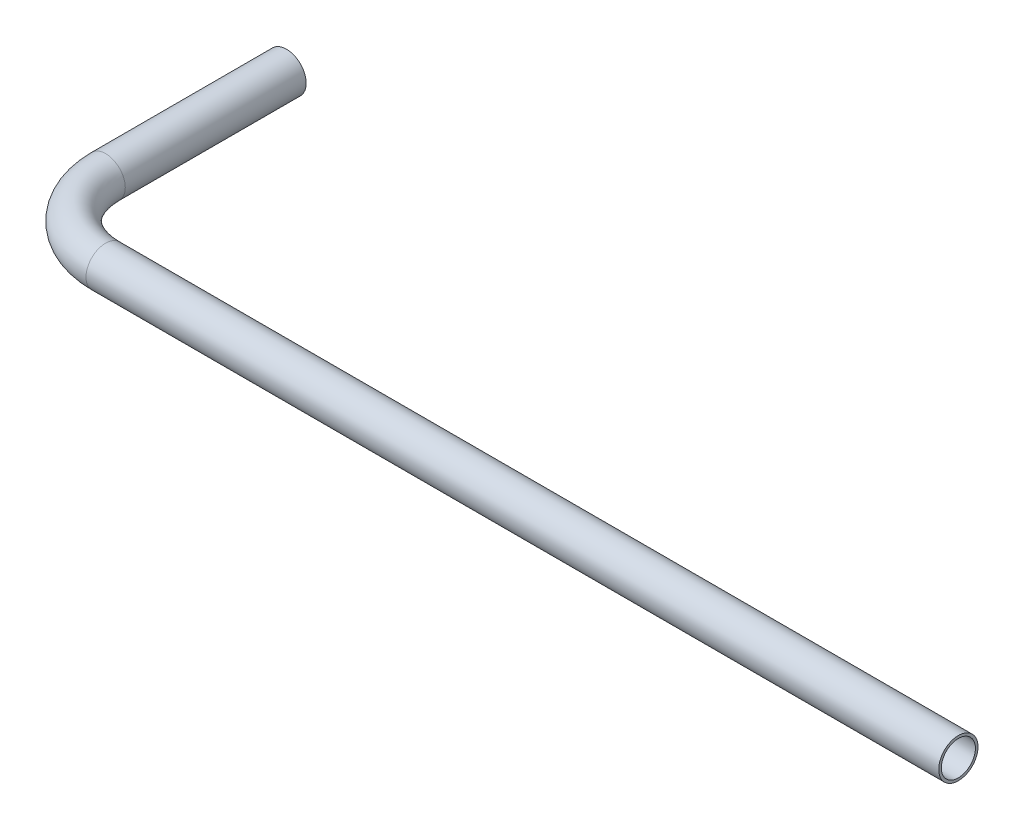
from build123d import *

# Parameters (mm, degrees)
SKETCH1_R   = 4.826
SKETCH1_R_2 = 4.191


with BuildPart() as part:
    # Sweep1: sweep along a curve in space
    with BuildLine() as sweep1_path:
        Line((0, 0, 0), (0, 0, 44.45))
        ThreePointArc((0, 0, 44.45), (5.579615818, 0, 57.920384182), (19.05, 0, 63.5))
        Line((19.05, 0, 63.5), (228.6, 0, 63.5))
    # Sketch1 → Sweep1 (sweep)
    with BuildSketch(Plane.XY):
        Circle(SKETCH1_R)
        Circle(SKETCH1_R_2, mode=Mode.SUBTRACT)
    sweep(path=sweep1_path.line)


solid = part.part
